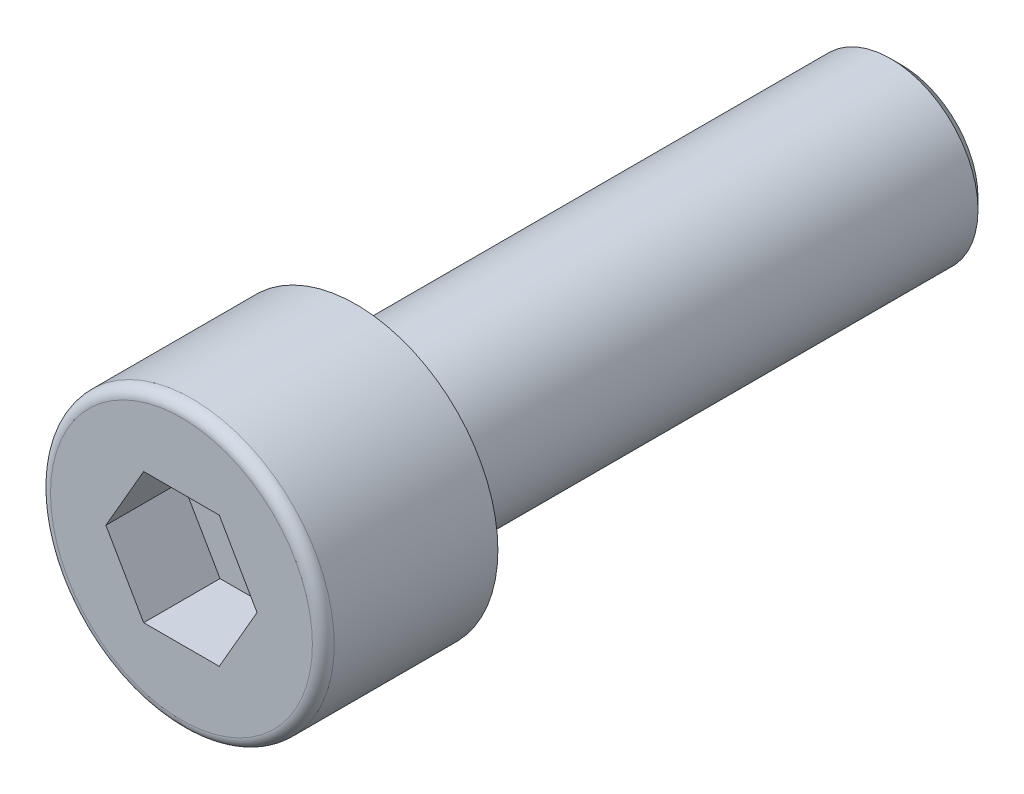
from build123d import *

# Parameters (mm, degrees)
ESQUISSE1_R             = 4
BASE_EXTRUSION_DEPTH    = 25
ESQUISSE2_R             = 6.5
BOSS_EXTRU_1_DEPTH      = 8
ENL_V_MAT_EXTRU_1_DEPTH = 3.5
CONG_2_R                = 0.5
CHANFREIN1_SIZE         = 0.5


with BuildPart() as part:
    # Esquisse1 → Base-Extrusion (new body)
    with BuildSketch(Plane.XY):
        Circle(ESQUISSE1_R)
    extrude(amount=BASE_EXTRUSION_DEPTH)

    # Esquisse2 → Boss.-Extru.1 (add)
    with BuildSketch(Plane.XY.offset(25)):
        Circle(ESQUISSE2_R)
    extrude(amount=BOSS_EXTRU_1_DEPTH)

    # Esquisse3 → Enlèv. mat.-Extru.1 (cut)
    with BuildSketch(Plane.XY.offset(33)):
        Polygon((-1.732050808, 3), (1.732050808, 3), (3.464101615, 0), (1.732050808, -3), (-1.732050808, -3), (-3.464101615, 0), align=None)
    extrude(amount=-ENL_V_MAT_EXTRU_1_DEPTH, mode=Mode.SUBTRACT)

    # Congé2
    cong_2_edges = [part.edges().sort_by_distance(p)[0] for p in [
        (-6.5, 0, 33),
    ]]
    fillet(cong_2_edges, radius=CONG_2_R)

    # Chanfrein1
    chanfrein1_edges = [part.edges().sort_by_distance(p)[0] for p in [
        (-4, 0, 0),
    ]]
    chamfer(chanfrein1_edges, length=CHANFREIN1_SIZE)


solid = part.part
